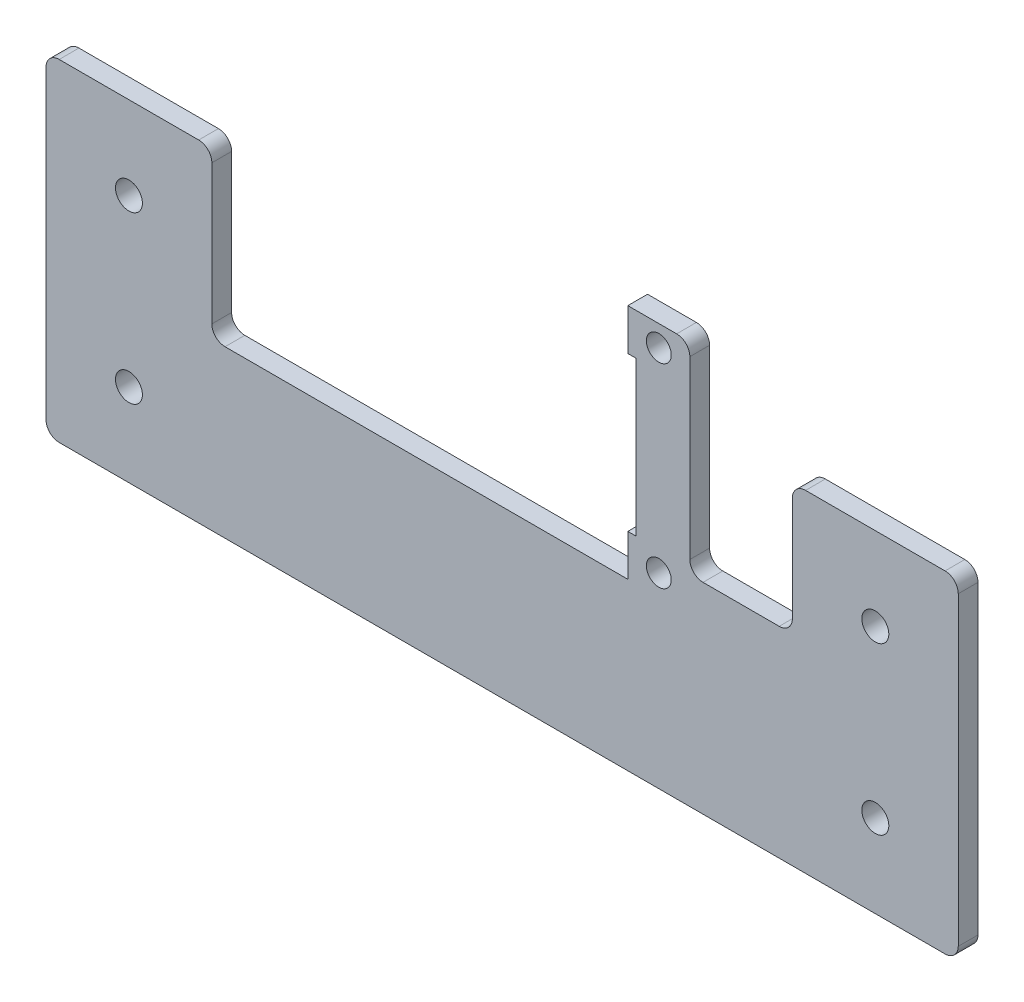
from build123d import *

# Parameters (mm, degrees)
SKETCH1_R           = 3.25
SKETCH1_R_2         = 3
BOSS_EXTRUDE1_DEPTH = 4.7625
FILLET3_R           = 3.18


with BuildPart() as part:
    # Sketch1 → Boss-Extrude1 (new body)
    with BuildSketch(Plane.XY):
        Polygon((27.466141976, -161.906947321), (27.466141976, -151.906947321), (42.428200405, -151.906947321), (42.428200405, -200.628730702), (67.157321136, -200.628730702), (67.157321136, -169.057449544), (107.157321136, -169.057449544), (107.157321136, -249.057449544), (-112.842678864, -249.057449544), (-112.842678864, -169.057449544), (-72.842678864, -169.057449544), (-72.842678864, -209.057449544), (27.466141976, -209.057449544), (27.466141976, -199.057449544), (29.50037366, -199.057449544), (29.50037366, -161.906947321), align=None)
        with Locations(Location((-92.842678864, -189.057449544, 0), (0, 0, 180))):
            Circle(SKETCH1_R, mode=Mode.SUBTRACT)
        with Locations(Location((87.157321136, -189.057449544, 0), (0, 0, 180))):
            Circle(SKETCH1_R, mode=Mode.SUBTRACT)
        with Locations(Location((87.157321136, -229.057449544, 0), (0, 0, 180))):
            Circle(SKETCH1_R, mode=Mode.SUBTRACT)
        with Locations(Location((-92.842678864, -229.057449544, 0), (0, 0, 180))):
            Circle(SKETCH1_R, mode=Mode.SUBTRACT)
        with Locations(Location((34.946141976, -203.976877703, 0), (0, 0, 180))):
            Circle(SKETCH1_R_2, mode=Mode.SUBTRACT)
        with Locations(Location((34.946141976, -156.986877707, 0), (0, 0, 180))):
            Circle(SKETCH1_R_2, mode=Mode.SUBTRACT)
    extrude(amount=BOSS_EXTRUDE1_DEPTH)

    # Fillet3
    fillet3_edges = [part.edges().sort_by_distance(p)[0] for p in [
        (-112.842678864, -169.057449544, 2.38125),
        (-72.842678864, -169.057449544, 2.38125),
        (-72.842678864, -209.057449544, 2.38125),
        (42.428200405, -151.906947321, 2.38125),
        (42.428200405, -200.628730702, 2.38125),
        (67.157321136, -200.628730702, 2.38125),
        (67.157321136, -169.057449544, 2.38125),
        (107.157321136, -169.057449544, 2.38125),
        (107.157321136, -249.057449544, 2.38125),
        (-112.842678864, -249.057449544, 2.38125),
    ]]
    fillet(fillet3_edges, radius=FILLET3_R)


solid = part.part
